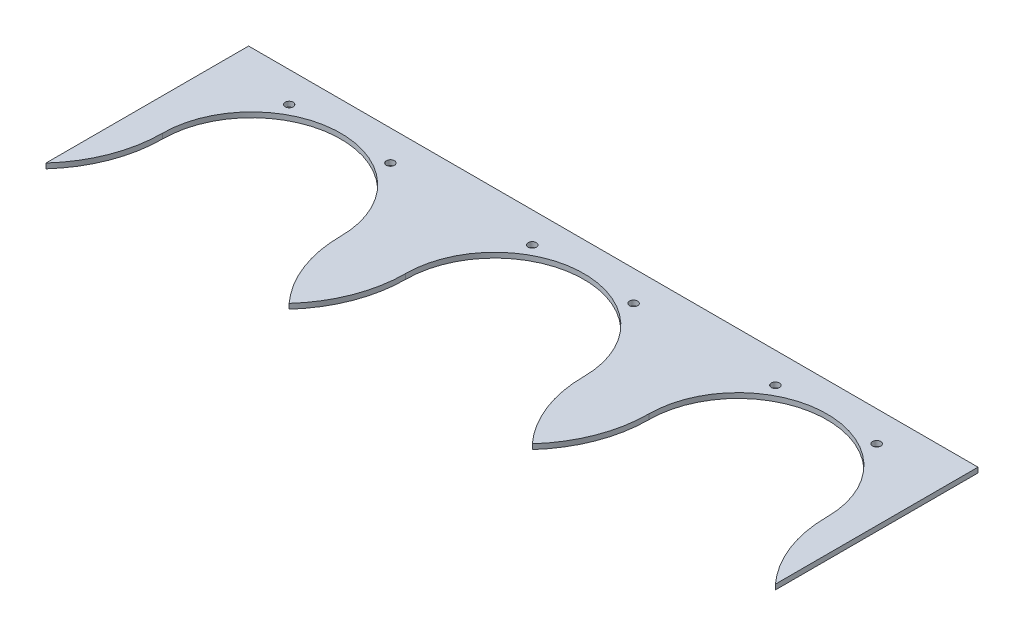
from build123d import *

# Parameters (mm, degrees)
SKETCH1_R           = 2.54
BOSS_EXTRUDE1_DEPTH = 3.175


with BuildPart() as part:
    # Sketch1 → Boss-Extrude1 (new body)
    with BuildSketch(Plane(origin=(0, 0, 0), x_dir=(1, 0, 0), z_dir=(0, 1, 0))):
        with BuildLine():
            ThreePointArc((-147.993238202, -11.693423436), (-142.737310664, -39.936650168), (-127.673238202, -64.398423436))
            ThreePointArc((-127.673238202, -64.398423436), (-112.609165741, -39.936650168), (-107.353238202, -11.693423436))
            ThreePointArc((-107.353238202, -11.693423436), (-51.473238202, 44.186576564), (4.406761798, -11.693423436))
            ThreePointArc((4.406761798, -11.693423436), (9.662689336, -39.936650168), (24.726761798, -64.398423436))
            ThreePointArc((24.726761798, -64.398423436), (39.790834259, -39.936650168), (45.046761798, -11.693423436))
            ThreePointArc((45.046761798, -11.693423436), (100.926761798, 44.186576564), (156.806761798, -11.693423436))
            ThreePointArc((156.806761798, -11.693423436), (162.062689336, -39.936650168), (177.126761798, -64.398423436))
            Line((177.126761798, -64.398423436), (177.126761798, 62.601576564))
            Line((177.126761798, 62.601576564), (-280.073238202, 62.601576564))
            Line((-280.073238202, 62.601576564), (-280.073238202, -64.398423436))
            ThreePointArc((-280.073238202, -64.398423436), (-265.009165741, -39.936650168), (-259.753238202, -11.693423436))
            ThreePointArc((-259.753238202, -11.693423436), (-203.873238202, 44.186576564), (-147.993238202, -11.693423436))
        make_face()
        with Locations((-235.623238202, 43.551576564)):
            Circle(SKETCH1_R, mode=Mode.SUBTRACT)
        with Locations((-172.123238202, 43.551576564)):
            Circle(SKETCH1_R, mode=Mode.SUBTRACT)
        with Locations((-19.723238202, 43.551576564)):
            Circle(SKETCH1_R, mode=Mode.SUBTRACT)
        with Locations((-83.223238202, 43.551576564)):
            Circle(SKETCH1_R, mode=Mode.SUBTRACT)
        with Locations((132.676761798, 43.551576564)):
            Circle(SKETCH1_R, mode=Mode.SUBTRACT)
        with Locations((69.176761798, 43.551576564)):
            Circle(SKETCH1_R, mode=Mode.SUBTRACT)
    extrude(amount=-BOSS_EXTRUDE1_DEPTH)


solid = part.part
